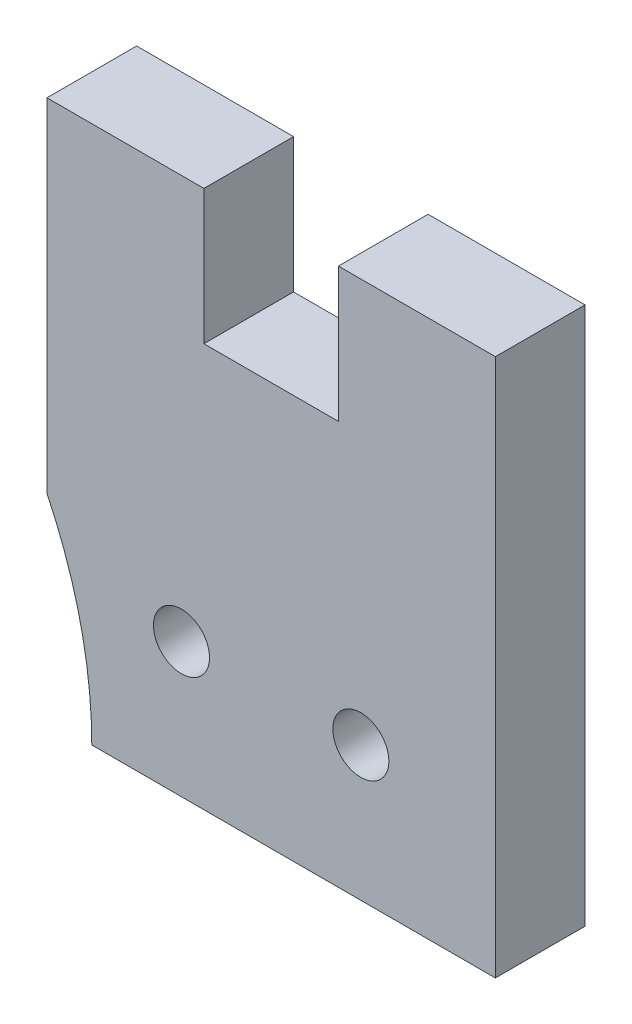
from build123d import *

# Parameters (mm, degrees)
BOSS_EXTRU_2_DEPTH      = 1
BOSS_EXTRU_2_DEPTH_BACK = 1
ESQUISSE3_R             = 0.625
ENL_V_MAT_EXTRU_1_DEPTH = 10


with BuildPart() as part:
    # Esquisse1 → Boss.-Extru.2 (new, two sides: drawn at the far end of the back side and taken through both)
    with BuildSketch(Plane.XY.offset(-BOSS_EXTRU_2_DEPTH_BACK)):
        with BuildLine():
            Line((0, 0), (9, 0))
            Line((9, 0), (9, 12))
            Line((9, 12), (5.5, 12))
            Line((5.5, 12), (5.5, 9))
            Line((5.5, 9), (2.5, 9))
            Line((2.5, 9), (2.5, 12))
            Line((2.5, 12), (-1, 12))
            Line((-1, 12), (-1, 4.358898944))
            ThreePointArc((-1, 4.358898944), (-0.253205655, 2.236067977), (0, 0))
        make_face()
    extrude(amount=BOSS_EXTRU_2_DEPTH + BOSS_EXTRU_2_DEPTH_BACK)

    # Esquisse3 → Enlèv. mat.-Extru.1 (cut)
    with BuildSketch(Plane.XY.offset(1)):
        with Locations((2, 3)):
            Circle(ESQUISSE3_R)
        with Locations((6, 3)):
            Circle(ESQUISSE3_R)
    extrude(amount=-ENL_V_MAT_EXTRU_1_DEPTH, mode=Mode.SUBTRACT)


solid = part.part
